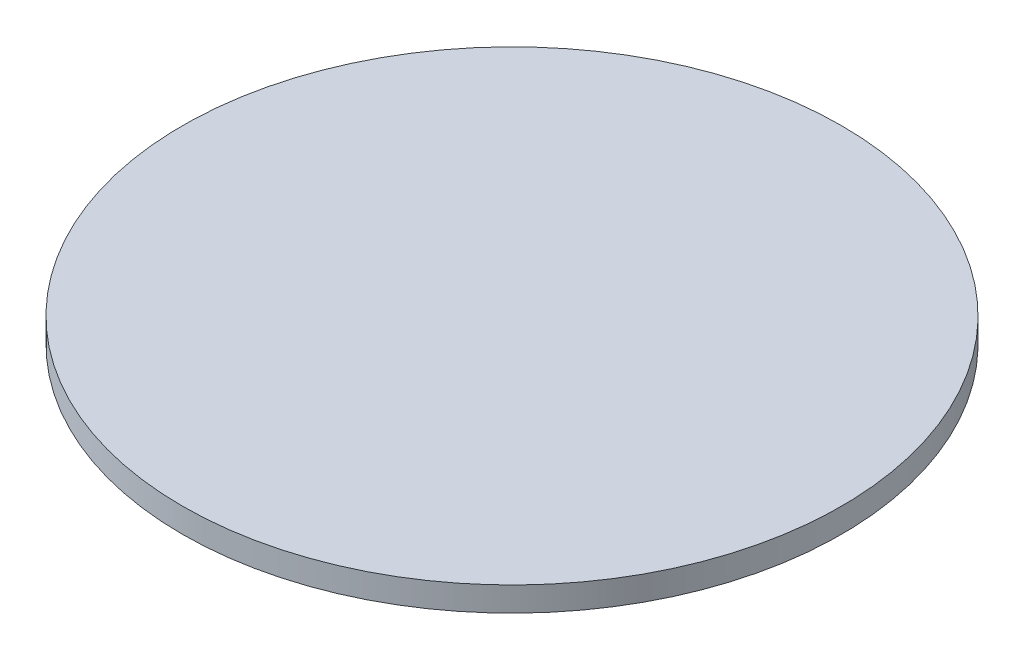
from build123d import *

# Parameters (mm, degrees)
SKETCH1_R           = 13.5
BOSS_EXTRUDE1_DEPTH = 1


with BuildPart() as part:
    # Sketch1 → Boss-Extrude1 (new body)
    with BuildSketch(Plane(origin=(0, 0, 0), x_dir=(1, 0, 0), z_dir=(0, 1, 0))):
        with Locations(Location((0, 0, 0), (0, 0, 270))):
            Circle(SKETCH1_R)
    extrude(amount=BOSS_EXTRUDE1_DEPTH)


solid = part.part
